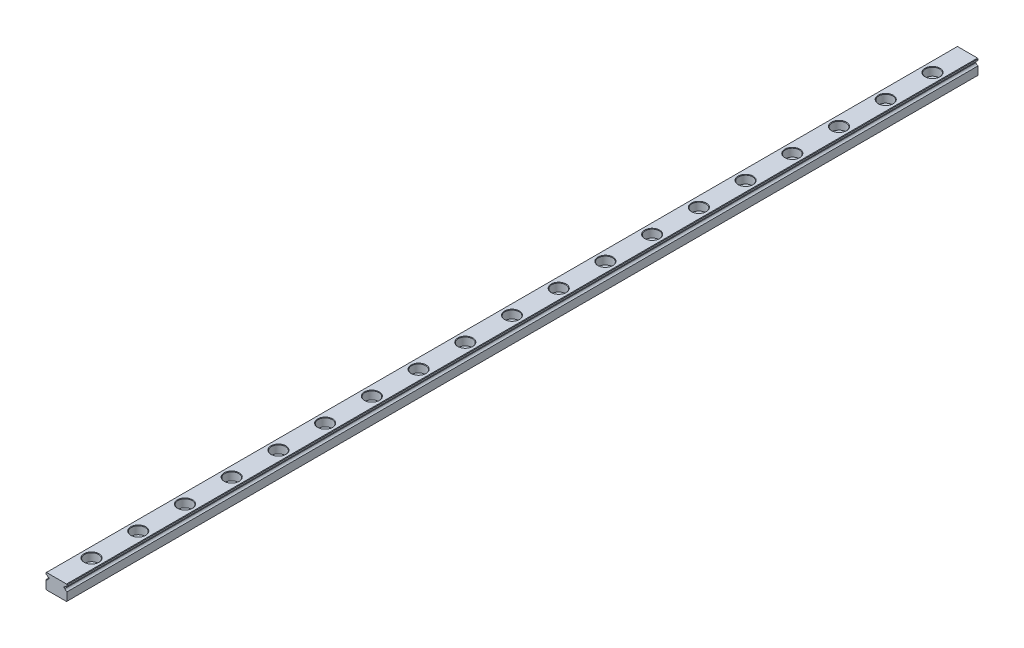
from build123d import *

# Parameters (mm, degrees)
EXTRUDE1_DEPTH             = 390
EXTRUDE2_REACH             = 392.08
SKETCH2_R                  = 1.75
SKETCH_R                   = 3
SKETCH_R_2                 = 1.75
EXTRUDE4_DEPTH             = 3.5
CHAMFER1_SIZE              = 0.2
LPATTERN1_COUNT            = 19
LPATTERN1_PITCH            = 20
CHAMFER1_OF_LPATTERN1_SIZE = 0.2


with BuildPart() as part:
    # Sketch1 → Extrude1 (new body)
    with BuildSketch(Plane.XY):
        with BuildLine():
            Line((-4.3, -3.25), (4.3, -3.25))
            Line((4.3, -3.25), (4.5, -3.05))
            Line((4.5, -3.05), (4.5, 0.455012563))
            ThreePointArc((4.5, 0.455012563), (3.924845827, 0.712323349), (3.617735397, 1.2625))
            Line((3.617735397, 1.2625), (3.15008224, 1.2625))
            Line((3.15008224, 1.2625), (3.15008224, 1.7625))
            Line((3.15008224, 1.7625), (3.65008224, 1.7625))
            ThreePointArc((3.65008224, 1.7625), (3.973877727, 2.229724887), (4.5, 2.444987437))
            Line((4.5, 2.444987437), (4.5, 3.05))
            Line((4.5, 3.05), (4.3, 3.25))
            Line((4.3, 3.25), (-4.3, 3.25))
            Line((-4.3, 3.25), (-4.5, 3.05))
            Line((-4.5, 3.05), (-4.5, 2.444987437))
            ThreePointArc((-4.5, 2.444987437), (-3.973877727, 2.229724887), (-3.65008224, 1.7625))
            Line((-3.65008224, 1.7625), (-3.15008224, 1.7625))
            Line((-3.15008224, 1.7625), (-3.15008224, 1.2625))
            Line((-3.15008224, 1.2625), (-3.617735397, 1.2625))
            ThreePointArc((-3.617735397, 1.2625), (-3.924845827, 0.712323349), (-4.5, 0.455012563))
            Line((-4.5, 0.455012563), (-4.5, -3.05))
            Line((-4.5, -3.05), (-4.3, -3.25))
        make_face()
    extrude(amount=EXTRUDE1_DEPTH)

    # Sketch2 → Extrude2 (cut, up to next)
    with BuildSketch(Plane(origin=(0, 3.25, 0), x_dir=(1, 0, 0), z_dir=(0, 1, 0)), mode=Mode.PRIVATE) as extrude2_sk1:
        with Locations((0, -15)):
            Circle(SKETCH2_R)
    extrude2_tool1 = extrude(extrude2_sk1.sketch, amount=-EXTRUDE2_REACH, mode=Mode.PRIVATE) & part.part
    extrude2 = extrude2_tool1.solids().sort_by_distance((0, 3.25, 15))[0]
    add(extrude2, mode=Mode.SUBTRACT)

    # Sketch → Extrude4 (cut)
    with BuildSketch(Plane(origin=(0, 3.25, 0), x_dir=(1, 0, 0), z_dir=(0, 1, 0))):
        with Locations((0, -15)):
            Circle(SKETCH_R)
        with Locations((0, -15)):
            Circle(SKETCH_R_2, mode=Mode.SUBTRACT)
    extrude4 = extrude(amount=-EXTRUDE4_DEPTH, mode=Mode.SUBTRACT)

    # Chamfer1
    chamfer1_edges = [part.edges().sort_by_distance(p)[0] for p in [
        (-1.75, -3.25, 15),
        (-3, 3.25, 15),
    ]]
    chamfer(chamfer1_edges, length=CHAMFER1_SIZE)

    # LPattern1: Extrude2, Extrude4 ×19
    with Locations(*[(0, 0, i * LPATTERN1_PITCH) for i in range(1, LPATTERN1_COUNT)]):
        add(extrude2, mode=Mode.SUBTRACT)
        add(extrude4, mode=Mode.SUBTRACT)

    # Chamfer1 of LPattern1
    chamfer1_of_lpattern1_edges = [part.edges().sort_by_distance(p)[0] for p in [
        (-1.75, -3.25, 35),
        (-3, 3.25, 35),
        (-1.75, -3.25, 55),
        (-3, 3.25, 55),
        (-1.75, -3.25, 75),
        (-3, 3.25, 75),
        (-1.75, -3.25, 95),
        (-3, 3.25, 95),
        (-1.75, -3.25, 115),
        (-3, 3.25, 115),
        (-1.75, -3.25, 135),
        (-3, 3.25, 135),
        (-1.75, -3.25, 155),
        (-3, 3.25, 155),
        (-1.75, -3.25, 175),
        (-3, 3.25, 175),
        (-1.75, -3.25, 195),
        (-3, 3.25, 195),
        (-1.75, -3.25, 215),
        (-3, 3.25, 215),
        (-1.75, -3.25, 235),
        (-3, 3.25, 235),
        (-1.75, -3.25, 255),
        (-3, 3.25, 255),
        (-1.75, -3.25, 275),
        (-3, 3.25, 275),
        (-1.75, -3.25, 295),
        (-3, 3.25, 295),
        (-1.75, -3.25, 315),
        (-3, 3.25, 315),
        (-1.75, -3.25, 335),
        (-3, 3.25, 335),
        (-1.75, -3.25, 355),
        (-3, 3.25, 355),
        (-1.75, -3.25, 375),
        (-3, 3.25, 375),
    ]]
    chamfer(chamfer1_of_lpattern1_edges, length=CHAMFER1_OF_LPATTERN1_SIZE)


solid = part.part
